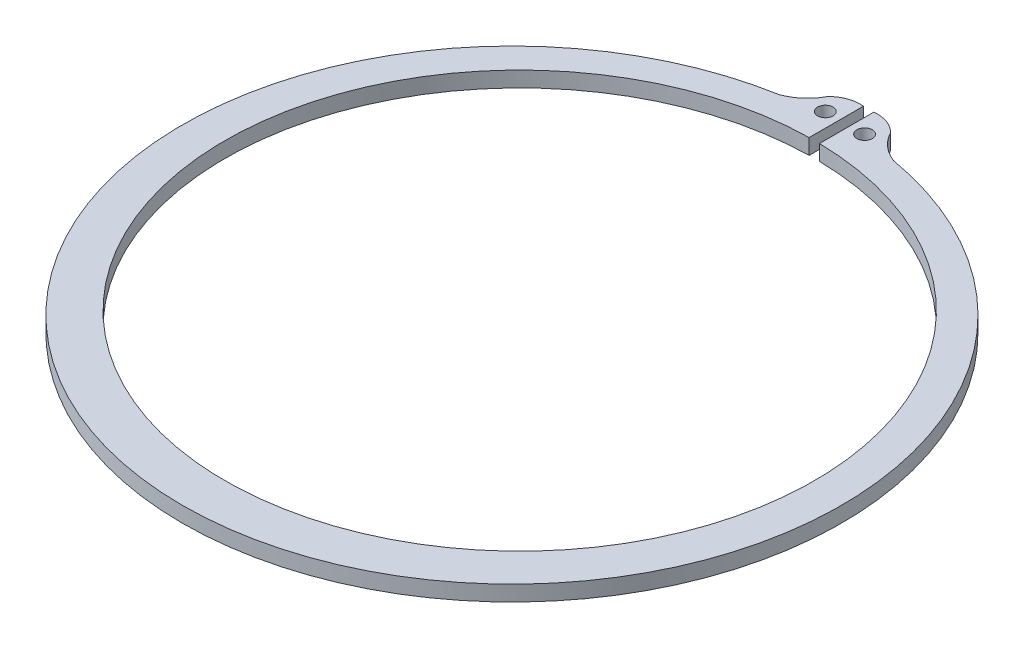
from build123d import *

# Parameters (mm, degrees)
RESSALTO_EXTRUS_O1_DEPTH = 2
ESBO_O2_R                = 0.995647449
CORTE_EXTRUS_O2_DEPTH    = 2


with BuildPart() as part:
    # Esboço1 → Ressalto-extrusão1 (new body)
    with BuildSketch(Plane(origin=(0, 0, 0), x_dir=(1, 0, 0), z_dir=(0, 1, 0))):
        with BuildLine():
            Line((-0.666666667, 44.994151597), (-0.666666667, 37.994151597))
            ThreePointArc((-0.666666667, 37.994151597), (0, -38), (0.666666667, 37.994151597))
            Line((0.666666667, 37.994151597), (0.666666667, 44.994151597))
            ThreePointArc((0.666666667, 44.994151597), (2.49667801, 44.780922159), (4.041161547, 43.776442735))
            ThreePointArc((4.041161547, 43.776442735), (5.433142777, 42.012216456), (7.361123559, 40.857661903))
            ThreePointArc((7.361123559, 40.857661903), (0, -43.5), (-7.361123559, 40.857661903))
            ThreePointArc((-7.361123559, 40.857661903), (-5.433142777, 42.012216456), (-4.041161547, 43.776442735))
            ThreePointArc((-4.041161547, 43.776442735), (-2.49667801, 44.780922159), (-0.666666667, 44.994151597))
        make_face()
    extrude(amount=RESSALTO_EXTRUS_O1_DEPTH)

    # Esboço2 → Corte-extrusão2 (cut)
    with BuildSketch(Plane(origin=(0, 2, 0), x_dir=(1, 0, 0), z_dir=(0, 1, 0))):
        with Locations(Location((-2.532286153, 41.944142536, 0), (0, 0, 270))):
            Circle(ESBO_O2_R)
        with Locations(Location((2.532286153, 41.944142536, 0), (0, 0, 90))):
            Circle(ESBO_O2_R)
    extrude(amount=-CORTE_EXTRUS_O2_DEPTH, mode=Mode.SUBTRACT)


solid = part.part
